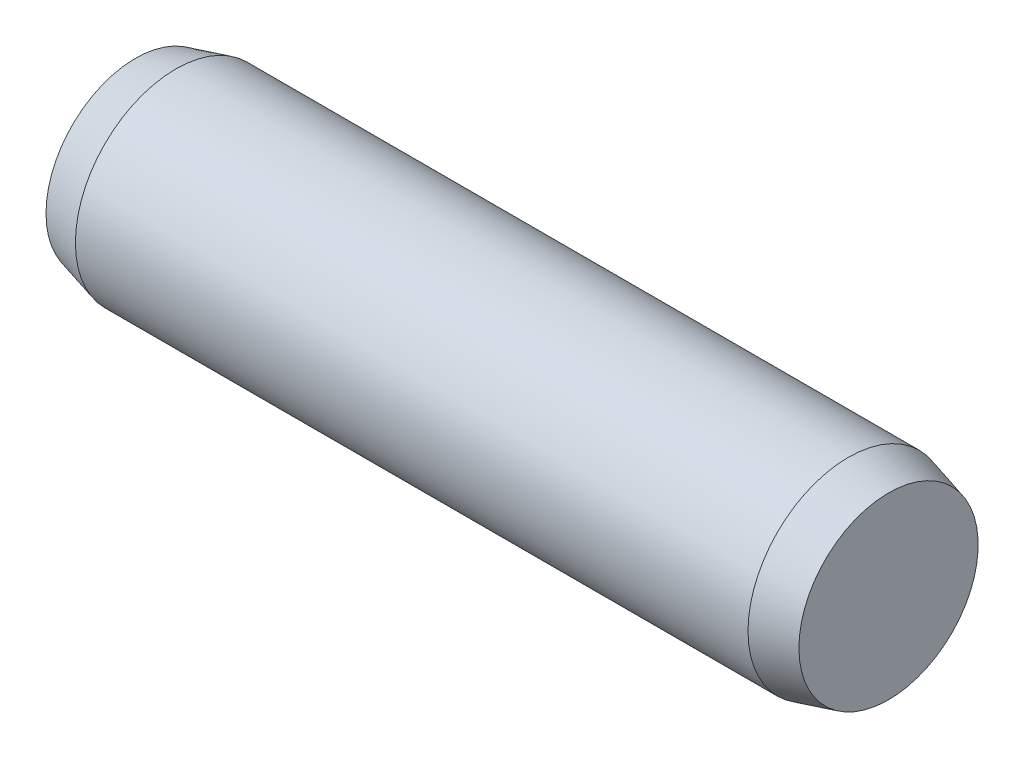
from build123d import *


with BuildPart() as part:
    # Sketch1 → Base-Revolve (revolve)
    with BuildSketch(Plane.XY, mode=Mode.PRIVATE) as base_revolve_sk:
        Polygon((0, 0), (30, 0), (30, 3.571281292), (28.4, 4), (1.6, 4), (0, 3.571281292), align=None)
    revolve(base_revolve_sk.sketch.rotate(Axis((-6.976683678, 0, 0), (1, 0, 0)), 90), axis=Axis((-6.976683678, 0, 0), (1, 0, 0)))


solid = part.part
